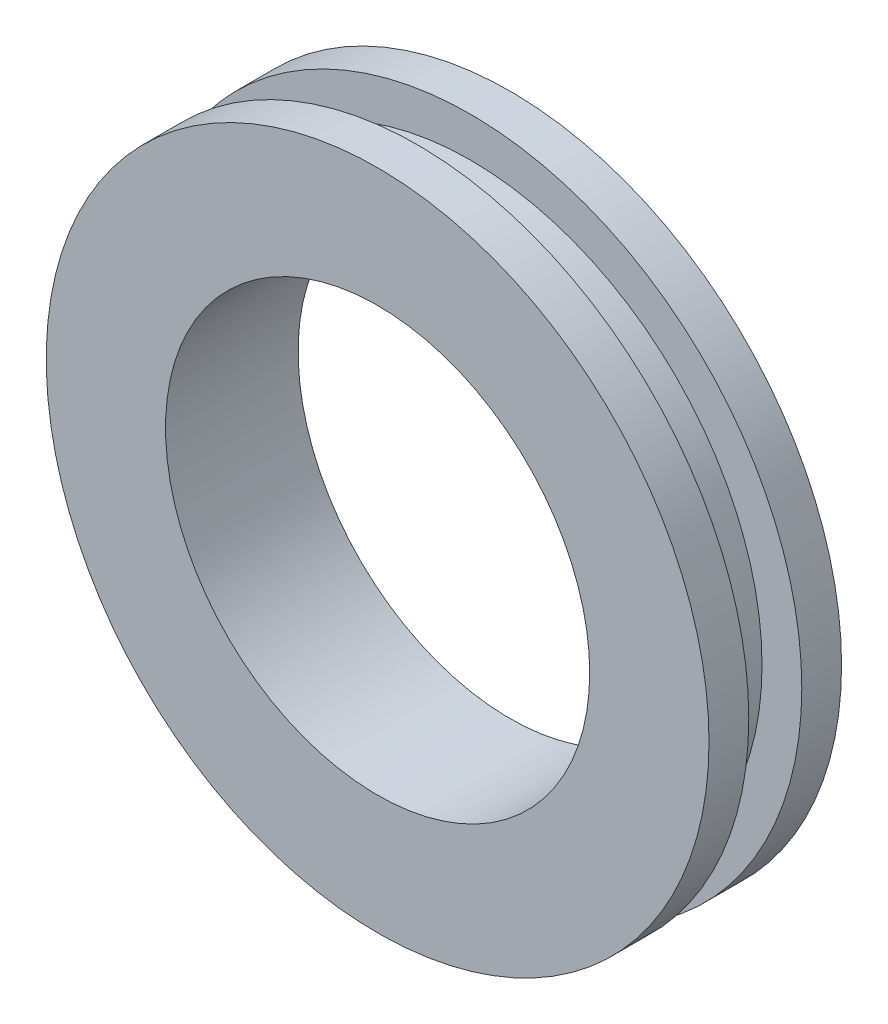
from build123d import *


with BuildPart() as part:
    # Croquis1 → Revolución1 (revolve)
    with BuildSketch(Plane(origin=(0, 0, 0), x_dir=(0, 0, -1), z_dir=(1, 0, 0)), mode=Mode.PRIVATE) as revoluci_n1_sk:
        Polygon((-2.5, 8), (2.5, 8), (2.5, 12.5), (1, 12.5), (1, 11), (-1, 11), (-1, 12.5), (-2.5, 12.5), align=None)
    revolve(revoluci_n1_sk.sketch.rotate(Axis((0, 0, 17.691339486), (0, 0, -1)), 90), axis=Axis((0, 0, 17.691339486), (0, 0, -1)))


solid = part.part
